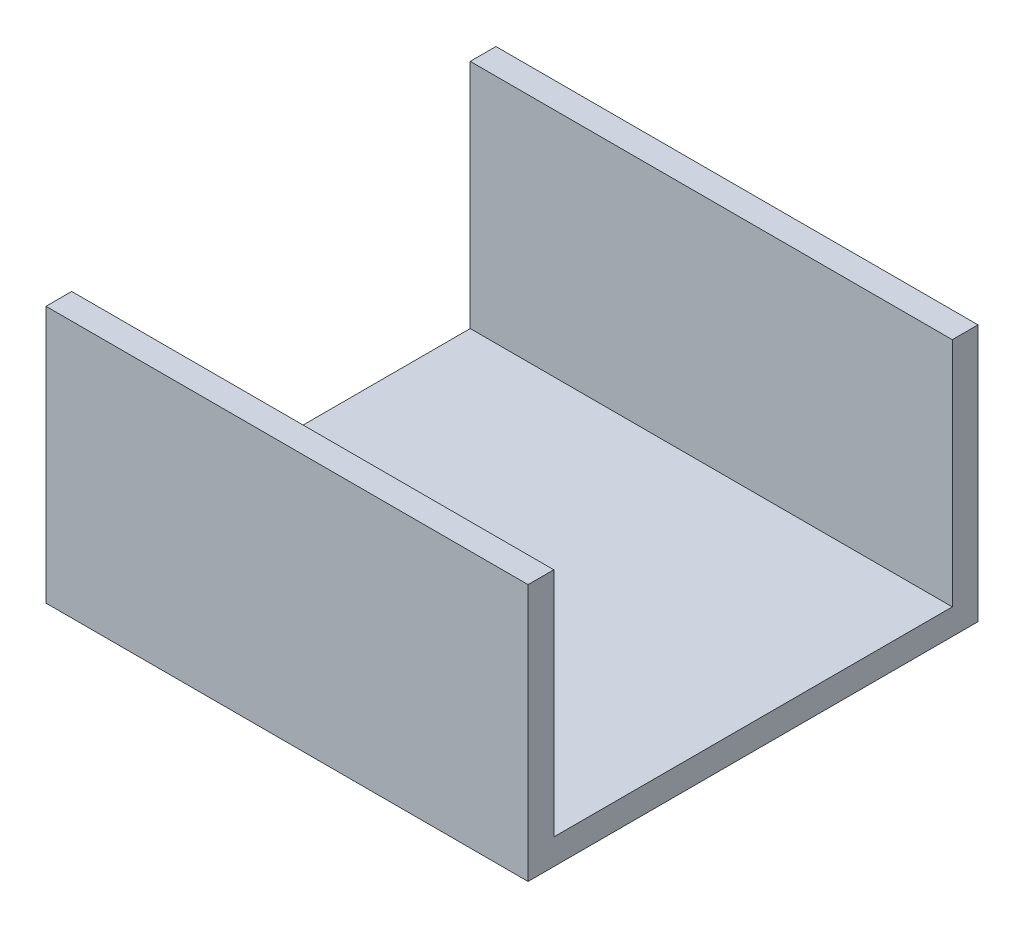
from build123d import *

# Parameters (mm, degrees)
SKETCH_1_W      = 75
SKETCH_1_H      = 70
EXTRUDE_1_DEPTH = 4
SKETCH_2_W      = 75
SKETCH_2_H      = 4
EXTRUDE_2_DEPTH = 36


with BuildPart() as part:
    # 스케치1 → 보스-돌출1 (new body)
    with BuildSketch(Plane(origin=(0, 0, 0), x_dir=(1, 0, 0), z_dir=(0, 1, 0))):
        with Locations((37.5, 35)):
            Rectangle(SKETCH_1_W, SKETCH_1_H)
    extrude(amount=EXTRUDE_1_DEPTH)

    # 스케치2 → 보스-돌출2 (add)
    with BuildSketch(Plane(origin=(0, 4, 0), x_dir=(1, 0, 0), z_dir=(0, 1, 0))):
        with Locations((37.5, 2)):
            Rectangle(SKETCH_2_W, SKETCH_2_H)
        with Locations((37.5, 68)):
            Rectangle(SKETCH_2_W, SKETCH_2_H)
    extrude(amount=EXTRUDE_2_DEPTH)


solid = part.part
